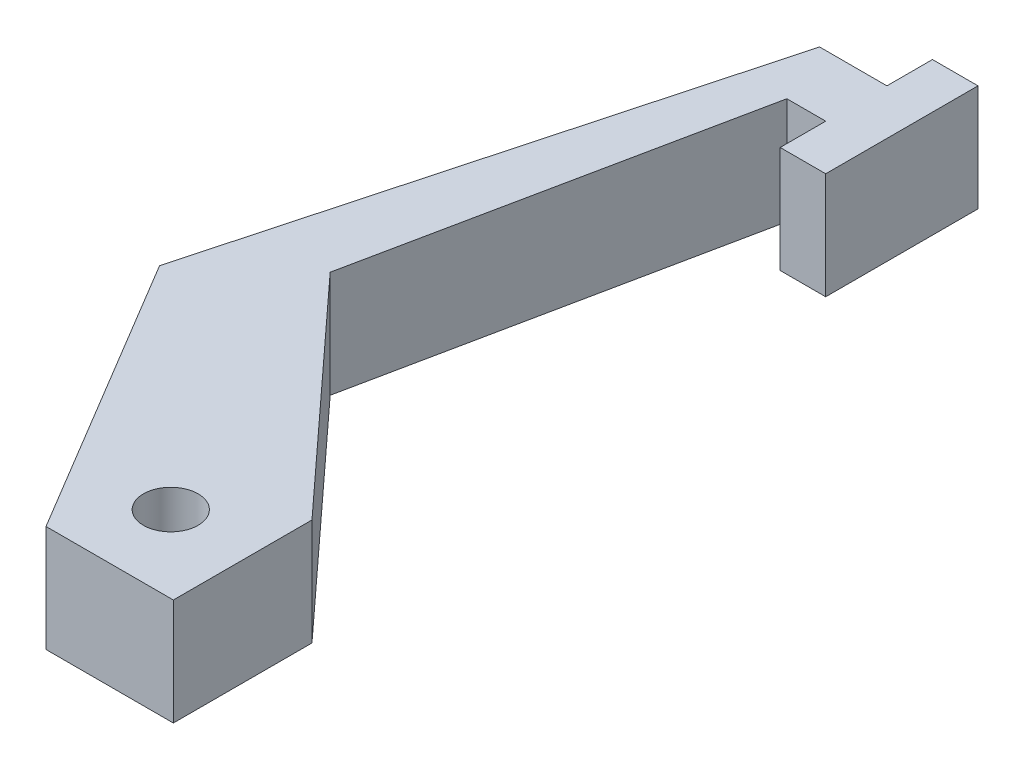
from build123d import *

# Parameters (mm, degrees)
SKETCH1_R           = 3
BOSS_EXTRUDE2_DEPTH = 11.7


with BuildPart() as part:
    # Sketch1 → Boss-Extrude2 (new body)
    with BuildSketch(Plane(origin=(0, 0, 0), x_dir=(1, 0, 0), z_dir=(0, 1, 0))):
        Polygon((0, 0), (-13.980822987, 0), (-32.542943678, 31.028387767), (-17.105764768, 88.055142801), (-9.7150509, 88.055142801), (-9.7150509, 93.055142801), (-4.7150509, 93.055142801), (-4.7150509, 76.335429628), (-9.7150509, 76.335429628), (-9.7150509, 81.335429628), (-13.980822987, 81.335429628), (-22.554180854, 39.771961165), (0, 15.218862691), align=None)
        with Locations(Location((-8.736754508, 8.454923717, 0), (0, 0, 270))):
            Circle(SKETCH1_R, mode=Mode.SUBTRACT)
    extrude(amount=BOSS_EXTRUDE2_DEPTH)


solid = part.part
